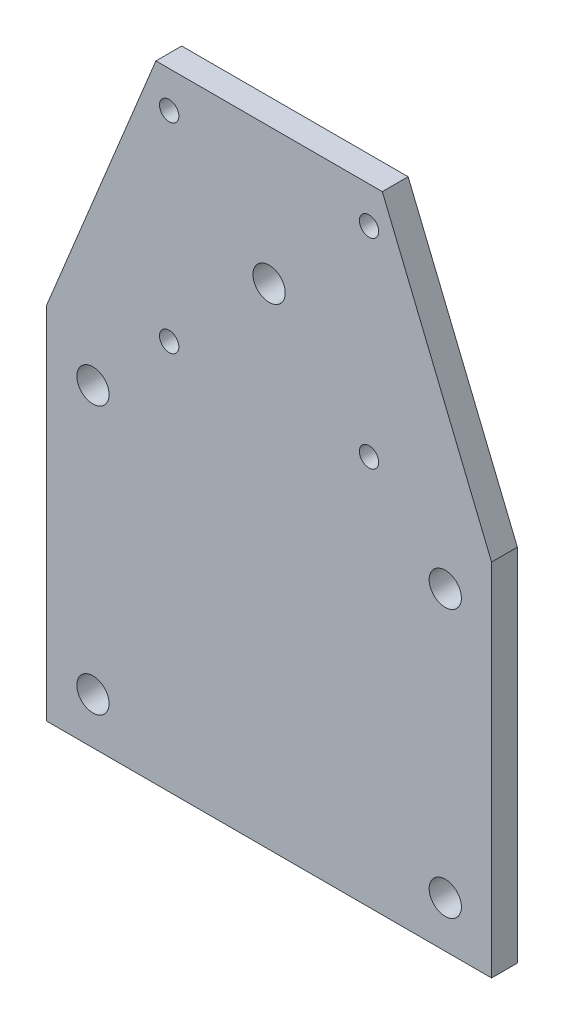
from build123d import *

# Parameters (mm, degrees)
SKETCH4_R           = 2.5
SKETCH4_R_2         = 1.5
BOSS_EXTRUDE1_DEPTH = 4


with BuildPart() as part:
    # Sketch4 → Boss-Extrude1 (new body)
    with BuildSketch(Plane.XY):
        Polygon((-34.504712973, -20.136303179), (-34.504712973, -76.004712973), (34.504712973, -76.004712973), (34.504712973, -20.136303179), (17.557897552, 21.15), (-17.557897552, 21.15), align=None)
        with Locations((-27.320508076, -27.320508076)):
            Circle(SKETCH4_R, mode=Mode.SUBTRACT)
        with Locations((27.320508076, -27.320508076)):
            Circle(SKETCH4_R, mode=Mode.SUBTRACT)
        with Locations((27.320508076, -68.820508076)):
            Circle(SKETCH4_R, mode=Mode.SUBTRACT)
        with Locations((-27.320508076, -68.820508076)):
            Circle(SKETCH4_R, mode=Mode.SUBTRACT)
        with Locations((-15.5, -15.5)):
            Circle(SKETCH4_R_2, mode=Mode.SUBTRACT)
        with Locations((-15.5, 15.5)):
            Circle(SKETCH4_R_2, mode=Mode.SUBTRACT)
        with Locations((15.5, 15.5)):
            Circle(SKETCH4_R_2, mode=Mode.SUBTRACT)
        with Locations((15.5, -15.5)):
            Circle(SKETCH4_R_2, mode=Mode.SUBTRACT)
        Circle(SKETCH4_R, mode=Mode.SUBTRACT)
    extrude(amount=BOSS_EXTRUDE1_DEPTH)


solid = part.part
